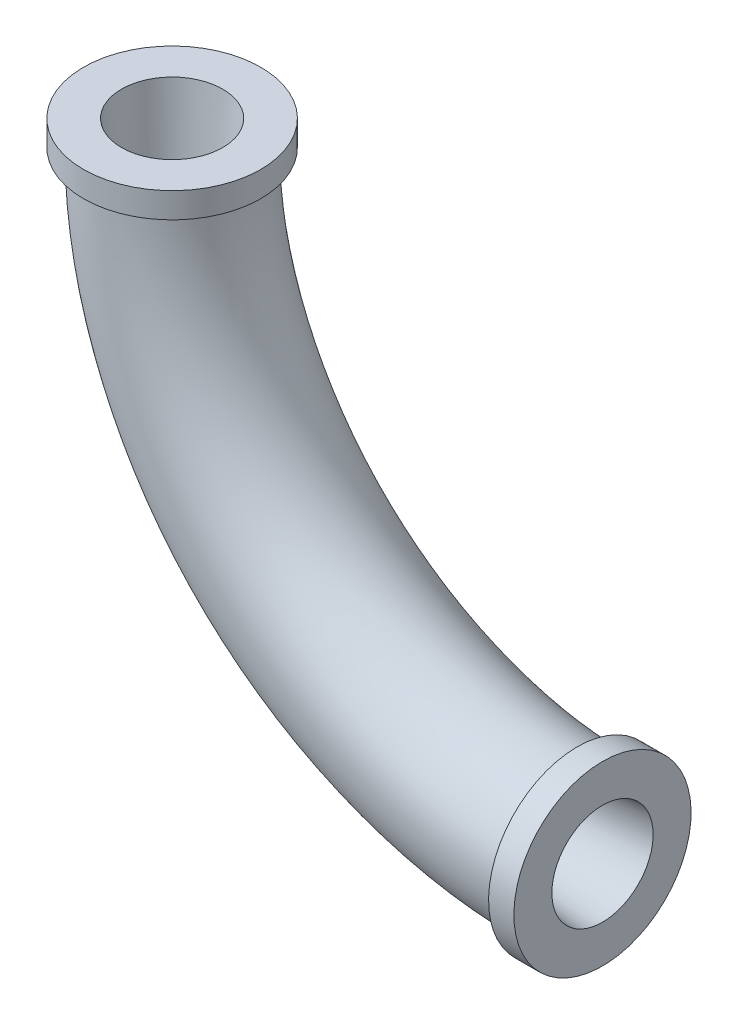
from build123d import *

# Parameters (mm, degrees)
SKETCH2_R           = 9.525
SKETCH3_R           = 11.1125
BOSS_EXTRUDE1_DEPTH = 3.175
SKETCH4_R           = 11.1125
BOSS_EXTRUDE2_DEPTH = 3.175
SKETCH5_R           = 6.35
CUT_EXTRUDE1_DEPTH  = 9.525
CUT_EXTRUDE1_DRAFT  = -5
SKETCH6_R           = 6.35
CUT_EXTRUDE2_DEPTH  = 9.525
CUT_EXTRUDE2_DRAFT  = -5


with BuildPart() as part:
    # Sweep2: sweep along a path in Sketch1
    with BuildLine(Plane.XY) as sweep2_path:
        ThreePointArc((-50.8, 0), (-35.921024484, -35.921024484), (0, -50.8))
    # Sketch2 → Sweep2 (sweep)
    with BuildSketch(Plane(origin=(0, 0, 0), x_dir=(1, 0, 0), z_dir=(0, 1, 0))):
        with Locations((-50.8, 0)):
            Circle(SKETCH2_R)
    sweep(path=sweep2_path.line)

    # Sketch3 → Boss-Extrude1 (add)
    with BuildSketch(Plane(origin=(0, 0, 0), x_dir=(1, 0, 0), z_dir=(0, 1, 0))):
        with Locations(Location((-50.8, 0, 0), (0, 0, 270))):
            Circle(SKETCH3_R)
    extrude(amount=BOSS_EXTRUDE1_DEPTH)

    # Sketch4 → Boss-Extrude2 (add)
    with BuildSketch(Plane(origin=(0, 0, 0), x_dir=(0, 0, -1), z_dir=(1, 0, 0))):
        with Locations(Location((0, -50.8, 0), (0, 0, 90))):
            Circle(SKETCH4_R)
    extrude(amount=BOSS_EXTRUDE2_DEPTH)


with BuildPart() as cut_extrude1_tool:
    # Sketch5 → Cut-Extrude1 (with draft: the straight prism first)
    with BuildSketch(Plane(origin=(0, 3.175, 0), x_dir=(1, 0, 0), z_dir=(0, 1, 0))):
        with Locations((-50.8, 0)):
            Circle(SKETCH5_R)
    extrude(amount=-CUT_EXTRUDE1_DEPTH)
    # Cut-Extrude1: the draft: its side faces are tilted about the plane it starts from
    cut_extrude1_sides = [cut_extrude1_tool.faces().sort_by_distance(p)[0] for p in [
        (-57.15, -1.5875, 0),
    ]]
    draft(cut_extrude1_sides, Plane(origin=(0, 3.175, 0), x_dir=(1, 0, 0), z_dir=(0, 1, 0)), CUT_EXTRUDE1_DRAFT)


with BuildPart() as part_1:
    add(part.part)

    # Cut-Extrude1: cut by cut_extrude1_tool
    add(cut_extrude1_tool.part, mode=Mode.SUBTRACT)


with BuildPart() as cut_extrude2_tool:
    # Sketch6 → Cut-Extrude2 (with draft: the straight prism first)
    with BuildSketch(Plane(origin=(3.175, 0, 0), x_dir=(0, 0, -1), z_dir=(1, 0, 0))):
        with Locations((0, -50.8)):
            Circle(SKETCH6_R)
    extrude(amount=-CUT_EXTRUDE2_DEPTH)
    # Cut-Extrude2: the draft: its side faces are tilted about the plane it starts from
    cut_extrude2_sides = [cut_extrude2_tool.faces().sort_by_distance(p)[0] for p in [
        (-1.5875, -50.8, 6.35),
    ]]
    draft(cut_extrude2_sides, Plane(origin=(3.175, 0, 0), x_dir=(0, 0, -1), z_dir=(1, 0, 0)), CUT_EXTRUDE2_DRAFT)


with BuildPart() as part_2:
    add(part_1.part)

    # Cut-Extrude2: cut by cut_extrude2_tool
    add(cut_extrude2_tool.part, mode=Mode.SUBTRACT)


solid = part_2.part
